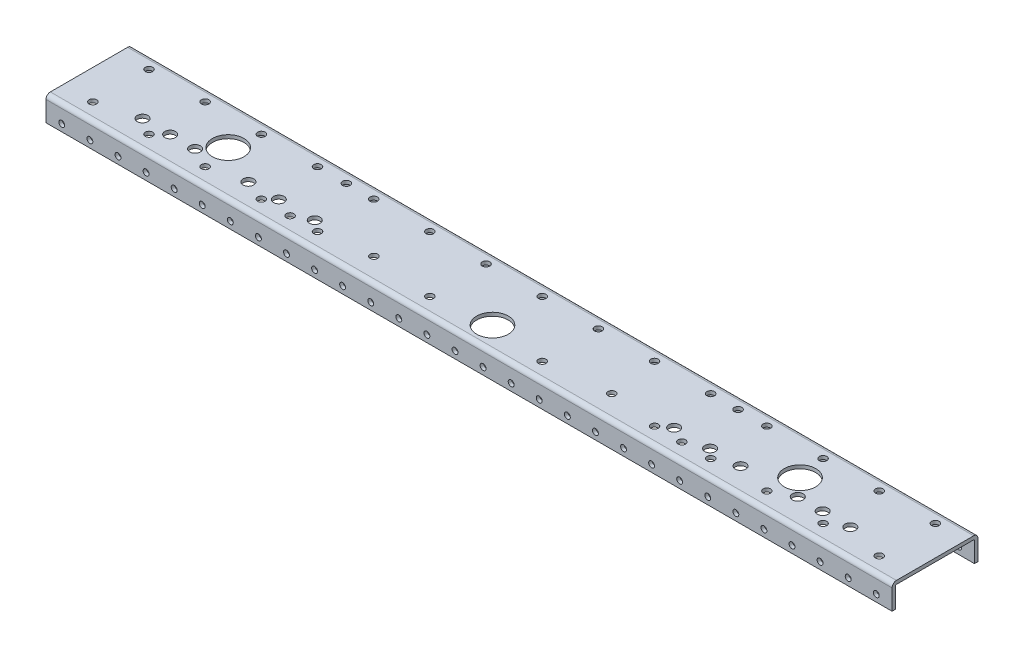
from build123d import *

# Parameters (mm, degrees)
SKETCH1_W                  = 812.8
SKETCH1_H                  = 77.724
BOSS_EXTRUDE1_DEPTH        = 22.225
SKETCH2_W                  = 71.374
SKETCH2_H                  = 19.05
CUT_EXTRUDE1_DEPTH         = 817.364663535
HOLE1_D                    = 9.652
HOLE2_D                    = 28.575
H_0_266_DIAMETER_HOLE1_D   = 6.7564
F_10_CLEARANCE_HOLE1_D     = 5.334
F_10_CLEARANCE_HOLE1_DEPTH = 3.175
F_10_CLEARANCE_HOLE2_D     = 5.334
F_10_CLEARANCE_HOLE2_DEPTH = 3.175
F_10_CLEARANCE_HOLE3_D     = 5.334
CHAMFER1_SIZE              = 3.175
FILLET1_R                  = 0.762
FILLET2_R                  = 3.937
CUT_EXTRUDE2_REACH         = 818.445
SKETCH15_W                 = 23.8125
SKETCH15_H                 = 77.724


with BuildPart() as part:
    # Sketch1 → Boss-Extrude1 (new body)
    with BuildSketch(Plane.XZ.offset(19.05)):
        with Locations((406.4, -34.925)):
            Rectangle(SKETCH1_W, SKETCH1_H)
    extrude(amount=-BOSS_EXTRUDE1_DEPTH)

    # Sketch2 → Cut-Extrude1 (cut, through all)
    with BuildSketch(Plane.ZY):
        with Locations((-34.925, -9.525)):
            Rectangle(SKETCH2_W, SKETCH2_H)
    extrude(amount=-CUT_EXTRUDE1_DEPTH, mode=Mode.SUBTRACT)

    # Hole1 (through all)
    with Locations(Plane(origin=(0, 0, 0), x_dir=(-1, 0, 0), z_dir=(0, -1, 0))):
        with Locations((-568.924874752, 19.05), (-601.438495912, 19.05), (-628.947697627, 19.05), (-243.875125248, 19.05), (-211.361504088, 19.05), (-183.852302373, 19.05), (-678.944202666, 20.828), (-701.450372003, 20.828), (-726.460886343, 20.828), (-133.855797334, 20.828), (-111.349627997, 20.828), (-86.339113657, 20.828)):
            Hole(HOLE1_D / 2)

    # Hole2 (through all)
    with Locations(Plane(origin=(0, 0, 0), x_dir=(-1, 0, 0), z_dir=(0, -1, 0))):
        with Locations((-664.970837168, 36.83), (-147.829162832, 36.83), (-406.4, 17.272)):
            Hole(HOLE2_D / 2)

    # H (0.266) Diameter Hole1 (through all)
    with Locations(Plane(origin=(0, 0, 0), x_dir=(-1, 0, 0), z_dir=(0, -1, 0))):
        with Locations((-762, 11.43), (-762, 62.23), (-711.2, 11.43), (-711.2, 62.23), (-660.4, 11.43), (-660.4, 62.23), (-609.6, 11.43), (-609.6, 62.23), (-558.8, 11.43), (-558.8, 62.23), (-152.4, 11.43), (-203.2, 62.23), (-203.2, 11.43), (-254, 62.23), (-50.8, 11.43), (-101.6, 62.23), (-101.6, 11.43), (-152.4, 62.23), (-254, 11.43), (-304.8, 62.23), (-355.6, 62.23), (-355.6, 11.43), (-508, 62.23), (-457.2, 11.43), (-457.2, 62.23), (-406.4, 62.23), (-50.8, 62.23), (-583.538437168, 62.23), (-583.538437168, 11.43), (-229.261562832, 11.43), (-229.261562832, 62.23), (-513.925467617, 17.547282407), (-298.874532383, 17.547282407)):
            Hole(H_0_266_DIAMETER_HOLE1_D / 2)

    # #10 Clearance Hole1
    with Locations(Plane(origin=(0, 0, 0.762), x_dir=(-1, 0, 0), z_dir=(0, 0, -1))):
        with Locations((-12.7, -12.7), (-800.1, -12.7)):
            Hole(F_10_CLEARANCE_HOLE1_D / 2, depth=F_10_CLEARANCE_HOLE1_DEPTH)

    # #10 Clearance Hole2
    with Locations(Plane.XY.offset(3.937)):
        with Locations((63.5, -12.7), (38.1, -12.7), (88.9, -12.7), (114.3, -12.7), (139.7, -12.7), (165.1, -12.7), (190.5, -12.7), (215.9, -12.7), (241.3, -12.7), (266.7, -12.7), (292.1, -12.7), (317.5, -12.7), (342.9, -12.7), (368.3, -12.7), (393.7, -12.7), (419.1, -12.7), (444.5, -12.7), (469.9, -12.7), (495.3, -12.7), (520.7, -12.7), (546.1, -12.7), (571.5, -12.7), (596.9, -12.7), (622.3, -12.7), (647.7, -12.7), (673.1, -12.7), (698.5, -12.7), (723.9, -12.7), (749.3, -12.7), (774.7, -12.7)):
            Hole(F_10_CLEARANCE_HOLE2_D / 2, depth=F_10_CLEARANCE_HOLE2_DEPTH)

    # #10 Clearance Hole3 (through all)
    with Locations(Plane.XY.offset(-70.612)):
        with Locations((800.1, -12.7), (774.7, -12.7), (749.3, -12.7), (723.9, -12.7), (698.5, -12.7), (673.1, -12.7), (647.7, -12.7), (622.3, -12.7), (596.9, -12.7), (571.5, -12.7), (546.1, -12.7), (520.7, -12.7), (495.3, -12.7), (469.9, -12.7), (444.5, -12.7), (419.1, -12.7), (393.7, -12.7), (368.3, -12.7), (342.9, -12.7), (317.5, -12.7), (292.1, -12.7), (266.7, -12.7), (241.3, -12.7), (215.9, -12.7), (190.5, -12.7), (165.1, -12.7), (139.7, -12.7), (114.3, -12.7), (88.9, -12.7), (63.5, -12.7), (38.1, -12.7), (12.7, -12.7)):
            Hole(F_10_CLEARANCE_HOLE3_D / 2)

    # Chamfer1
    chamfer1_edges = [part.edges().sort_by_distance(p)[0] for p in [
        (812.8, -19.05, 2.3495),
        (0, -19.05, -72.1995),
        (0, -19.05, 2.3495),
        (812.8, -19.05, -72.1995),
    ]]
    chamfer(chamfer1_edges, length=CHAMFER1_SIZE)

    # Fillet1
    fillet1_edges = [part.edges().sort_by_distance(p)[0] for p in [
        (406.4, 0, -70.612),
        (406.4, 0, 0.762),
    ]]
    fillet(fillet1_edges, radius=FILLET1_R)

    # Fillet2
    fillet2_edges = [part.edges().sort_by_distance(p)[0] for p in [
        (406.4, 3.175, -73.787),
        (406.4, 3.175, 3.937),
    ]]
    fillet(fillet2_edges, radius=FILLET2_R)

    # Sketch15 → Cut-Extrude2 (cut, up to next)
    with BuildSketch(Plane(origin=(0, 3.175, 0), x_dir=(1, 0, 0), z_dir=(0, 1, 0)), mode=Mode.PRIVATE) as cut_extrude2_sk1:
        with Locations((11.90625, 34.925)):
            Rectangle(SKETCH15_W, SKETCH15_H)
    cut_extrude2_tool1 = extrude(cut_extrude2_sk1.sketch, amount=-CUT_EXTRUDE2_REACH, mode=Mode.PRIVATE) & part.part
    # Sketch15 → Cut-Extrude2 (cut, up to next)
    with BuildSketch(Plane(origin=(0, 3.175, 0), x_dir=(1, 0, 0), z_dir=(0, 1, 0)), mode=Mode.PRIVATE) as cut_extrude2_sk2:
        with Locations((800.89375, 34.925)):
            Rectangle(SKETCH15_W, SKETCH15_H)
    cut_extrude2_tool2 = extrude(cut_extrude2_sk2.sketch, amount=-CUT_EXTRUDE2_REACH, mode=Mode.PRIVATE) & part.part
    add(cut_extrude2_tool1.solids().sort_by_distance((11.90625, 3.175, -34.925))[0], mode=Mode.SUBTRACT)
    add(cut_extrude2_tool2.solids().sort_by_distance((800.89375, 3.175, -34.925))[0], mode=Mode.SUBTRACT)


solid = part.part
